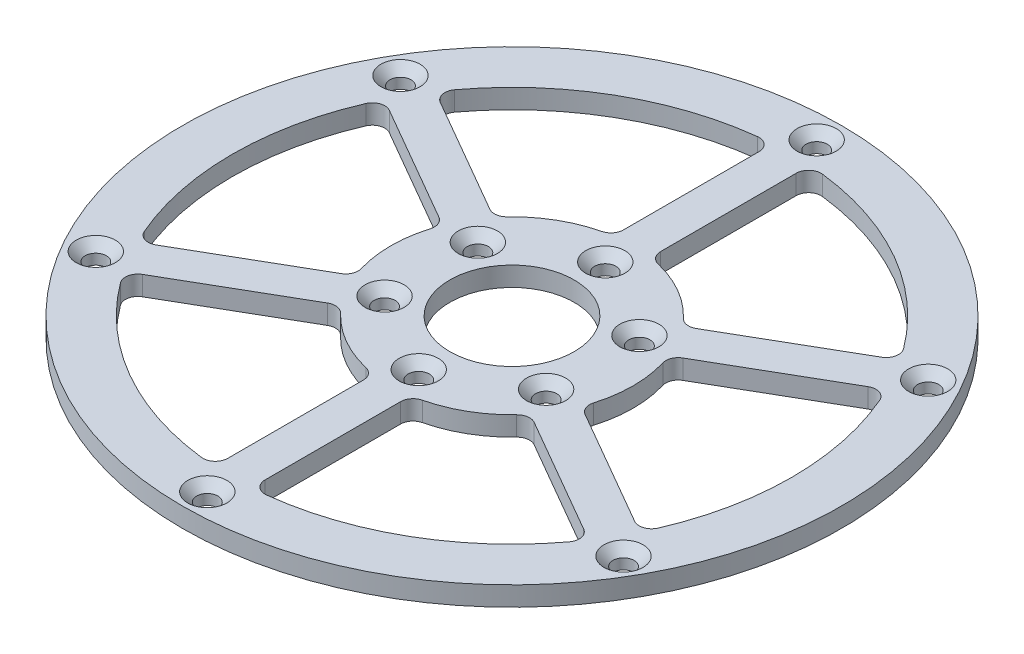
from build123d import *

# Parameters (mm, degrees)
SKETCH1_R                                      = 53
SKETCH1_R_2                                    = 10
BOSS_EXTRUDE1_DEPTH                            = 3.125
CUT_EXTRUDE1_DEPTH                             = 76.018435234
SKETCH3_R                                      = 1.6
CUT_EXTRUDE2_DEPTH                             = 76.018435234
SKETCH5_R                                      = 1.6
CUT_EXTRUDE3_DEPTH                             = 76.018435234
CSK_FOR_M3_FLAT_HEAD_MACHINE_SCREW1_AT_2_COUNT = 2
CSK_FOR_M3_FLAT_HEAD_MACHINE_SCREW1_AT_2_PITCH = 15
CSK_FOR_M3_FLAT_HEAD_MACHINE_SCREW1_AT_3_COUNT = 2
CSK_FOR_M3_FLAT_HEAD_MACHINE_SCREW1_AT_3_PITCH = 25.980762114
CSK_FOR_M3_FLAT_HEAD_MACHINE_SCREW1_AT_4_COUNT = 2
CSK_FOR_M3_FLAT_HEAD_MACHINE_SCREW1_AT_4_PITCH = 43.48562981
CSK_FOR_M3_FLAT_HEAD_MACHINE_SCREW1_AT_5_COUNT = 2
CSK_FOR_M3_FLAT_HEAD_MACHINE_SCREW1_AT_5_PITCH = 34
CSK_FOR_M3_FLAT_HEAD_MACHINE_SCREW1_AT_6_COUNT = 2
CSK_FOR_M3_FLAT_HEAD_MACHINE_SCREW1_AT_6_PITCH = 43.48562981
CSK_FOR_M3_FLAT_HEAD_MACHINE_SCREW1_AT_7_COUNT = 2
CSK_FOR_M3_FLAT_HEAD_MACHINE_SCREW1_AT_7_PITCH = 25.980762114
CSK_FOR_M3_FLAT_HEAD_MACHINE_SCREW1_AT_8_COUNT = 2
CSK_FOR_M3_FLAT_HEAD_MACHINE_SCREW1_AT_8_PITCH = 15
CSK_FOR_M3_FLAT_HEAD_MACHINE_SCREW1_AT_9_COUNT = 2
CSK_FOR_M3_FLAT_HEAD_MACHINE_SCREW1_AT_9_PITCH = 30
CSK_FOR_M3_FLAT_HEAD_MACHINE_SCREW1_AT_1_COUNT = 2
CSK_FOR_M3_FLAT_HEAD_MACHINE_SCREW1_AT_1_PITCH = 57.974132163
CSK_FOR_M3_FLAT_HEAD_MACHINE_SCREW1_2_COUNT    = 2
CSK_FOR_M3_FLAT_HEAD_MACHINE_SCREW1_2_PITCH    = 64
CSK_FOR_M3_FLAT_HEAD_MACHINE_SCREW1_3_COUNT    = 2
CSK_FOR_M3_FLAT_HEAD_MACHINE_SCREW1_3_PITCH    = 57.974132163


with BuildPart() as part:
    # Sketch1 → Boss-Extrude1 (new body)
    with BuildSketch(Plane(origin=(0, 0, 0), x_dir=(1, 0, 0), z_dir=(0, 1, 0))):
        with Locations(Location((0, 0, 0), (0, 0, 270))):
            Circle(SKETCH1_R)
        with Locations(Location((0, 0, 0), (0, 0, 270))):
            Circle(SKETCH1_R_2, mode=Mode.SUBTRACT)
    extrude(amount=BOSS_EXTRUDE1_DEPTH)

    # Sketch2 → Cut-Extrude1 (cut, through all)
    with BuildSketch(Plane(origin=(0, 3.125, 0), x_dir=(1, 0, 0), z_dir=(0, 1, 0))):
        with BuildLine():
            Line((3, 42.708313008), (3, 20.910523666))
            ThreePointArc((3, 20.910523666), (3.429931123, 19.671619424), (4.534883721, 18.965358674))
            ThreePointArc((4.534883721, 18.965358674), (9.75, 16.887495374), (14.157040543, 13.410003843))
            ThreePointArc((14.157040543, 13.410003843), (15.321156594, 12.806217198), (16.609044701, 13.053338045))
            Line((16.609044701, 13.053338045), (35.486484018, 23.952232715))
            ThreePointArc((35.486484018, 23.952232715), (36.445203153, 25.280031933), (36.09050653, 26.878901361))
            ThreePointArc((36.09050653, 26.878901361), (22.5, 38.97114317), (5.23255814, 44.694746171))
            ThreePointArc((5.23255814, 44.694746171), (3.670548286, 44.202487743), (3, 42.708313008))
        make_face()
        with BuildLine():
            Line((38.486484018, -18.756080293), (19.609044701, -7.857185622))
            ThreePointArc((19.609044701, -7.857185622), (18.751087716, -6.865402227), (18.691924264, -5.555354832))
            ThreePointArc((18.691924264, -5.555354832), (19.5, 0), (18.691924264, 5.555354832))
            ThreePointArc((18.691924264, 5.555354832), (18.751087716, 6.865402227), (19.609044701, 7.857185622))
            Line((19.609044701, 7.857185622), (38.486484018, 18.756080293))
            ThreePointArc((38.486484018, 18.756080293), (40.115751439, 18.92245581), (41.32306467, 17.81584481))
            ThreePointArc((41.32306467, 17.81584481), (45, 0), (41.32306467, -17.81584481))
            ThreePointArc((41.32306467, -17.81584481), (40.115751439, -18.92245581), (38.486484018, -18.756080293))
        make_face()
        with BuildLine():
            Line((3, -42.708313008), (3, -20.910523666))
            ThreePointArc((3, -20.910523666), (3.429931123, -19.671619424), (4.534883721, -18.965358674))
            ThreePointArc((4.534883721, -18.965358674), (9.75, -16.887495374), (14.157040543, -13.410003843))
            ThreePointArc((14.157040543, -13.410003843), (15.321156594, -12.806217198), (16.609044701, -13.053338045))
            Line((16.609044701, -13.053338045), (35.486484018, -23.952232715))
            ThreePointArc((35.486484018, -23.952232715), (36.445203153, -25.280031933), (36.09050653, -26.878901361))
            ThreePointArc((36.09050653, -26.878901361), (22.5, -38.97114317), (5.23255814, -44.694746171))
            ThreePointArc((5.23255814, -44.694746171), (3.670548286, -44.202487743), (3, -42.708313008))
        make_face()
        with BuildLine():
            Line((-35.486484018, -23.952232715), (-16.609044701, -13.053338045))
            ThreePointArc((-16.609044701, -13.053338045), (-15.321156594, -12.806217198), (-14.157040543, -13.410003843))
            ThreePointArc((-14.157040543, -13.410003843), (-9.75, -16.887495374), (-4.534883721, -18.965358674))
            ThreePointArc((-4.534883721, -18.965358674), (-3.429931123, -19.671619424), (-3, -20.910523666))
            Line((-3, -20.910523666), (-3, -42.708313008))
            ThreePointArc((-3, -42.708313008), (-3.670548286, -44.202487743), (-5.23255814, -44.694746171))
            ThreePointArc((-5.23255814, -44.694746171), (-22.5, -38.97114317), (-36.09050653, -26.878901361))
            ThreePointArc((-36.09050653, -26.878901361), (-36.445203153, -25.280031933), (-35.486484018, -23.952232715))
        make_face()
        with BuildLine():
            Line((-38.486484018, 18.756080293), (-19.609044701, 7.857185622))
            ThreePointArc((-19.609044701, 7.857185622), (-18.751087716, 6.865402227), (-18.691924264, 5.555354832))
            ThreePointArc((-18.691924264, 5.555354832), (-19.5, 0), (-18.691924264, -5.555354832))
            ThreePointArc((-18.691924264, -5.555354832), (-18.751087716, -6.865402227), (-19.609044701, -7.857185622))
            Line((-19.609044701, -7.857185622), (-38.486484018, -18.756080293))
            ThreePointArc((-38.486484018, -18.756080293), (-40.115751439, -18.92245581), (-41.32306467, -17.81584481))
            ThreePointArc((-41.32306467, -17.81584481), (-45, 0), (-41.32306467, 17.81584481))
            ThreePointArc((-41.32306467, 17.81584481), (-40.115751439, 18.92245581), (-38.486484018, 18.756080293))
        make_face()
        with BuildLine():
            Line((-3, 42.708313008), (-3, 20.910523666))
            ThreePointArc((-3, 20.910523666), (-3.429931123, 19.671619424), (-4.534883721, 18.965358674))
            ThreePointArc((-4.534883721, 18.965358674), (-9.75, 16.887495374), (-14.157040543, 13.410003843))
            ThreePointArc((-14.157040543, 13.410003843), (-15.321156594, 12.806217198), (-16.609044701, 13.053338045))
            Line((-16.609044701, 13.053338045), (-35.486484018, 23.952232715))
            ThreePointArc((-35.486484018, 23.952232715), (-36.445203153, 25.280031933), (-36.09050653, 26.878901361))
            ThreePointArc((-36.09050653, 26.878901361), (-22.5, 38.97114317), (-5.23255814, 44.694746171))
            ThreePointArc((-5.23255814, 44.694746171), (-3.670548286, 44.202487743), (-3, 42.708313008))
        make_face()
    extrude(amount=-CUT_EXTRUDE1_DEPTH, mode=Mode.SUBTRACT)

    # Sketch3 → Cut-Extrude2 (cut, through all)
    with BuildSketch(Plane(origin=(0, 3.125, 0), x_dir=(1, 0, 0), z_dir=(0, 1, 0))):
        with Locations(Location((0, 15, 0), (0, 0, 270))):
            Circle(SKETCH3_R)
        with Locations(Location((12.990381057, 7.5, 0), (0, 0, 270))):
            Circle(SKETCH3_R)
        with Locations(Location((12.990381057, -7.5, 0), (0, 0, 270))):
            Circle(SKETCH3_R)
        with Locations(Location((0, -15, 0), (0, 0, 270))):
            Circle(SKETCH3_R)
        with Locations(Location((-12.990381057, -7.5, 0), (0, 0, 270))):
            Circle(SKETCH3_R)
        with Locations(Location((-12.990381057, 7.5, 0), (0, 0, 270))):
            Circle(SKETCH3_R)
    extrude(amount=-CUT_EXTRUDE2_DEPTH, mode=Mode.SUBTRACT)

    # Sketch5 → Cut-Extrude3 (cut, through all)
    with BuildSketch(Plane(origin=(0, 3.125, 0), x_dir=(1, 0, 0), z_dir=(0, 1, 0))):
        with Locations(Location((-42.435244785, 24.5, 0), (0, 0, 270))):
            Circle(SKETCH5_R)
        with Locations(Location((0, 49, 0), (0, 0, 270))):
            Circle(SKETCH5_R)
        with Locations(Location((42.435244785, 24.5, 0), (0, 0, 270))):
            Circle(SKETCH5_R)
        with Locations(Location((42.435244785, -24.5, 0), (0, 0, 270))):
            Circle(SKETCH5_R)
        with Locations(Location((0, -49, 0), (0, 0, 270))):
            Circle(SKETCH5_R)
        with Locations(Location((-42.435244785, -24.5, 0), (0, 0, 270))):
            Circle(SKETCH5_R)
    extrude(amount=-CUT_EXTRUDE3_DEPTH, mode=Mode.SUBTRACT)

    # Sketch4 → CSK for M3 Flat Head Machine Screw1 (revolve, cut)
    with BuildSketch(Plane(origin=(0, 3.125, -15), x_dir=(0, 0, 1), z_dir=(1, 0, 0))):
        Polygon((0, 0), (0, 3.125), (1.7, 3.125), (1.7, 1.45), (3.15, 0), align=None)
    csk_for_m3_flat_head_machine_screw1 = revolve(axis=Axis((0, 9.475, -15), (0, -1, 0)), mode=Mode.SUBTRACT)

    # CSK for M3 Flat Head Machine Screw1 at 2: CSK for M3 Flat Head Machine Screw1 ×2
    with Locations(*[Vector(0.8660254037844346, 0, 0.5000000000000072) * (i * CSK_FOR_M3_FLAT_HEAD_MACHINE_SCREW1_AT_2_PITCH) for i in range(1, CSK_FOR_M3_FLAT_HEAD_MACHINE_SCREW1_AT_2_COUNT)]):
        add(csk_for_m3_flat_head_machine_screw1, mode=Mode.SUBTRACT)

    # CSK for M3 Flat Head Machine Screw1 at 3: CSK for M3 Flat Head Machine Screw1 ×2
    with Locations(*[Vector(0.499999999999998, 0, 0.8660254037844398) * (i * CSK_FOR_M3_FLAT_HEAD_MACHINE_SCREW1_AT_3_PITCH) for i in range(1, CSK_FOR_M3_FLAT_HEAD_MACHINE_SCREW1_AT_3_COUNT)]):
        add(csk_for_m3_flat_head_machine_screw1, mode=Mode.SUBTRACT)

    # CSK for M3 Flat Head Machine Screw1 at 4: CSK for M3 Flat Head Machine Screw1 ×2
    with Locations(*[Vector(-0.9758452383129322, 0, -0.21846297366367742) * (i * CSK_FOR_M3_FLAT_HEAD_MACHINE_SCREW1_AT_4_PITCH) for i in range(1, CSK_FOR_M3_FLAT_HEAD_MACHINE_SCREW1_AT_4_COUNT)]):
        add(csk_for_m3_flat_head_machine_screw1, mode=Mode.SUBTRACT)

    # CSK for M3 Flat Head Machine Screw1 at 5: CSK for M3 Flat Head Machine Screw1 ×2
    with Locations(*[(0, 0, -i * CSK_FOR_M3_FLAT_HEAD_MACHINE_SCREW1_AT_5_PITCH) for i in range(1, CSK_FOR_M3_FLAT_HEAD_MACHINE_SCREW1_AT_5_COUNT)]):
        add(csk_for_m3_flat_head_machine_screw1, mode=Mode.SUBTRACT)

    # CSK for M3 Flat Head Machine Screw1 at 6: CSK for M3 Flat Head Machine Screw1 ×2
    with Locations(*[Vector(0.975845238312932, 0, -0.2184629736636784) * (i * CSK_FOR_M3_FLAT_HEAD_MACHINE_SCREW1_AT_6_PITCH) for i in range(1, CSK_FOR_M3_FLAT_HEAD_MACHINE_SCREW1_AT_6_COUNT)]):
        add(csk_for_m3_flat_head_machine_screw1, mode=Mode.SUBTRACT)

    # CSK for M3 Flat Head Machine Screw1 at 7: CSK for M3 Flat Head Machine Screw1 ×2
    with Locations(*[Vector(-0.500000000000004, 0, 0.8660254037844364) * (i * CSK_FOR_M3_FLAT_HEAD_MACHINE_SCREW1_AT_7_PITCH) for i in range(1, CSK_FOR_M3_FLAT_HEAD_MACHINE_SCREW1_AT_7_COUNT)]):
        add(csk_for_m3_flat_head_machine_screw1, mode=Mode.SUBTRACT)

    # CSK for M3 Flat Head Machine Screw1 at 8: CSK for M3 Flat Head Machine Screw1 ×2
    with Locations(*[Vector(-0.8660254037844416, 0, 0.499999999999995) * (i * CSK_FOR_M3_FLAT_HEAD_MACHINE_SCREW1_AT_8_PITCH) for i in range(1, CSK_FOR_M3_FLAT_HEAD_MACHINE_SCREW1_AT_8_COUNT)]):
        add(csk_for_m3_flat_head_machine_screw1, mode=Mode.SUBTRACT)

    # CSK for M3 Flat Head Machine Screw1 at 9: CSK for M3 Flat Head Machine Screw1 ×2
    with Locations(*[(0, 0, i * CSK_FOR_M3_FLAT_HEAD_MACHINE_SCREW1_AT_9_PITCH) for i in range(1, CSK_FOR_M3_FLAT_HEAD_MACHINE_SCREW1_AT_9_COUNT)]):
        add(csk_for_m3_flat_head_machine_screw1, mode=Mode.SUBTRACT)

    # CSK for M3 Flat Head Machine Screw1 at 1: CSK for M3 Flat Head Machine Screw1 ×2
    with Locations(*[Vector(-0.7319686074206584, 0, 0.6813383577567478) * (i * CSK_FOR_M3_FLAT_HEAD_MACHINE_SCREW1_AT_1_PITCH) for i in range(1, CSK_FOR_M3_FLAT_HEAD_MACHINE_SCREW1_AT_1_COUNT)]):
        add(csk_for_m3_flat_head_machine_screw1, mode=Mode.SUBTRACT)

    # CSK for M3 Flat Head Machine Screw1  2: CSK for M3 Flat Head Machine Screw1 ×2
    with Locations(*[(0, 0, i * CSK_FOR_M3_FLAT_HEAD_MACHINE_SCREW1_2_PITCH) for i in range(1, CSK_FOR_M3_FLAT_HEAD_MACHINE_SCREW1_2_COUNT)]):
        add(csk_for_m3_flat_head_machine_screw1, mode=Mode.SUBTRACT)

    # CSK for M3 Flat Head Machine Screw1  3: CSK for M3 Flat Head Machine Screw1 ×2
    with Locations(*[Vector(0.7319686074206511, 0, 0.6813383577567558) * (i * CSK_FOR_M3_FLAT_HEAD_MACHINE_SCREW1_3_PITCH) for i in range(1, CSK_FOR_M3_FLAT_HEAD_MACHINE_SCREW1_3_COUNT)]):
        add(csk_for_m3_flat_head_machine_screw1, mode=Mode.SUBTRACT)


solid = part.part
